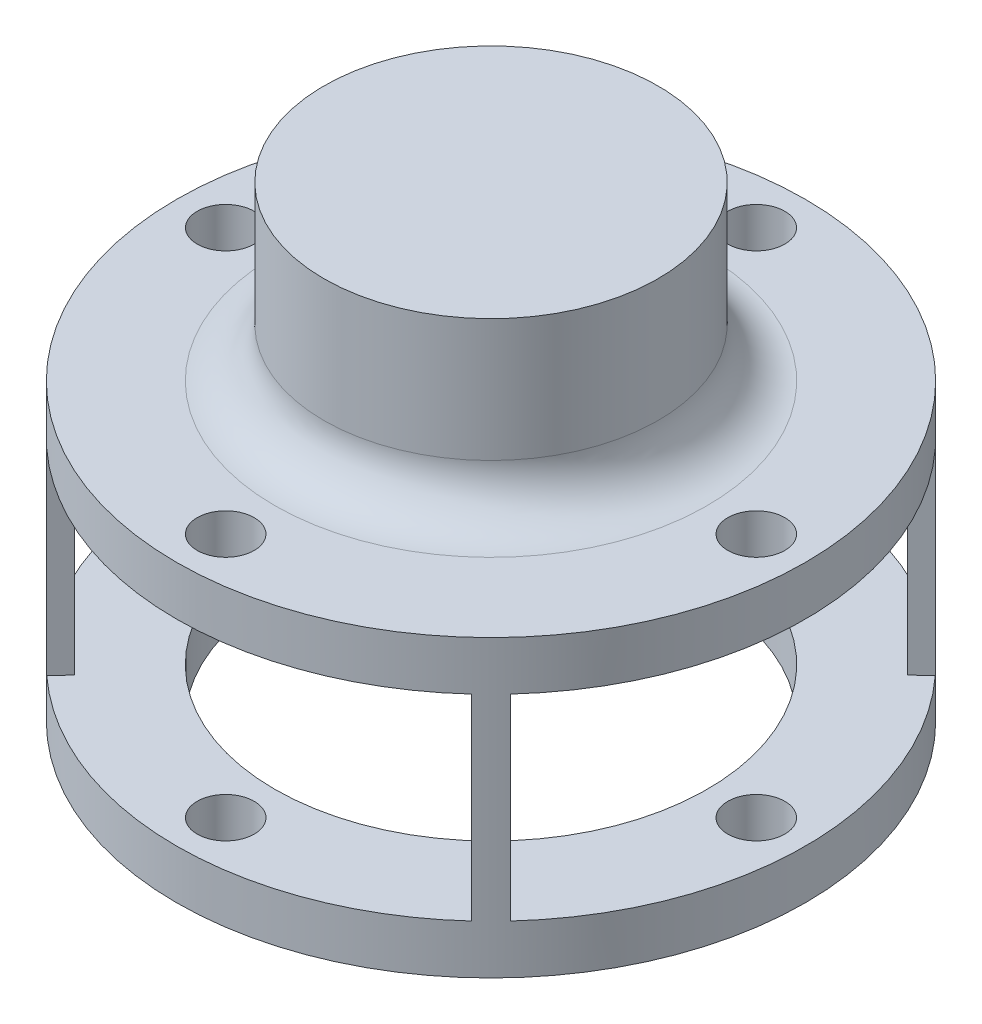
from build123d import *
from build123d.topology import SkipClean

# Parameters (mm, degrees)
SKETCH1_R               = 32
BOSS_EXTRUDE1_DEPTH     = 5
BOSS_EXTRUDE4_DEPTH     = 20
SKETCH5_R               = 32
BOSS_EXTRUDE5_DEPTH     = 5
CUT_EXTRUDE1_DEPTH      = 52.701063819
CUT_EXTRUDE1_DEPTH_BACK = 5
SKETCH2_7_R             = 2.9
SKETCH1_3_R             = 22
CUT_EXTRUDE2_DEPTH      = 10
SKETCH6_R               = 17
BOSS_EXTRUDE7_DEPTH     = 17.5
FILLET1_R               = 5


with BuildPart() as part:
    # Sketch1 → Boss-Extrude1 (new body)
    with BuildSketch(Plane(origin=(0, 0, 0), x_dir=(1, 0, 0), z_dir=(0, 1, 0))):
        Circle(SKETCH1_R)
    extrude(amount=BOSS_EXTRUDE1_DEPTH)

    # Sketch2 → Boss-Extrude4 (add)
    with SkipClean():  # the faces are left unmerged after this step: merging them gives an invalid solid
        with BuildSketch(Plane(origin=(0, 5, 0), x_dir=(1, 0, 0), z_dir=(0, 1, 0))):
            with BuildLine():
                Line((-23.592874778, 21.618886644), (-22.118320104, 20.267706228))
                ThreePointArc((-22.118320104, 20.267706228), (-21.213203436, 21.213203436), (-20.267706228, 22.118320104))
                Line((-20.267706228, 22.118320104), (-21.618886644, 23.592874778))
                ThreePointArc((-21.618886644, 23.592874778), (-22.627416998, 22.627416998), (-23.592874778, 21.618886644))
            make_face()
            with BuildLine():
                Line((23.592874778, 21.618886644), (22.118320104, 20.267706228))
                ThreePointArc((22.118320104, 20.267706228), (21.213203436, 21.213203436), (20.267706228, 22.118320104))
                Line((20.267706228, 22.118320104), (21.618886644, 23.592874778))
                ThreePointArc((21.618886644, 23.592874778), (22.627416998, 22.627416998), (23.592874778, 21.618886644))
            make_face()
            with BuildLine():
                Line((21.618886644, -23.592874778), (20.267706228, -22.118320104))
                ThreePointArc((20.267706228, -22.118320104), (21.213203436, -21.213203436), (22.118320104, -20.267706228))
                Line((22.118320104, -20.267706228), (23.592874778, -21.618886644))
                ThreePointArc((23.592874778, -21.618886644), (22.627416998, -22.627416998), (21.618886644, -23.592874778))
            make_face()
            with BuildLine():
                Line((-23.592874778, -21.618886644), (-22.118320104, -20.267706228))
                ThreePointArc((-22.118320104, -20.267706228), (-21.213203436, -21.213203436), (-20.267706228, -22.118320104))
                Line((-20.267706228, -22.118320104), (-21.618886644, -23.592874778))
                ThreePointArc((-21.618886644, -23.592874778), (-22.627416998, -22.627416998), (-23.592874778, -21.618886644))
            make_face()
        extrude(amount=BOSS_EXTRUDE4_DEPTH)

    # Sketch5 → Boss-Extrude5 (add)
    with SkipClean():  # the faces are left unmerged after this step: merging them gives an invalid solid
        with BuildSketch(Plane(origin=(0, 25, 0), x_dir=(1, 0, 0), z_dir=(0, 1, 0))):
            Circle(SKETCH5_R)
        extrude(amount=BOSS_EXTRUDE5_DEPTH)

    # Sketch2<7> → Cut-Extrude1 (cut, two sides: drawn at the far end of the back side and taken through both)
    with SkipClean():  # the faces are left unmerged after this step: merging them gives an invalid solid
        with BuildSketch(Plane(origin=(0, 5, 0), x_dir=(1, 0, 0), z_dir=(0, 1, 0)).offset(-CUT_EXTRUDE1_DEPTH_BACK)):
            with Locations((0, 27)):
                Circle(SKETCH2_7_R)
            with Locations((27, 0)):
                Circle(SKETCH2_7_R)
            with Locations((0, -27)):
                Circle(SKETCH2_7_R)
            with Locations((-27, 0)):
                Circle(SKETCH2_7_R)
        extrude(amount=CUT_EXTRUDE1_DEPTH + CUT_EXTRUDE1_DEPTH_BACK, mode=Mode.SUBTRACT)

    # Sketch1<3> → Cut-Extrude2 (cut)
    with SkipClean():  # the faces are left unmerged after this step: merging them gives an invalid solid
        with BuildSketch(Plane(origin=(0, 0, 0), x_dir=(1, 0, 0), z_dir=(0, 1, 0))):
            Circle(SKETCH1_3_R)
        extrude(amount=CUT_EXTRUDE2_DEPTH, mode=Mode.SUBTRACT)

    # Sketch6 → Boss-Extrude7 (add)
    with SkipClean():  # the faces are left unmerged after this step: merging them gives an invalid solid
        with BuildSketch(Plane(origin=(0, 30, 0), x_dir=(1, 0, 0), z_dir=(0, 1, 0))):
            Circle(SKETCH6_R)
        extrude(amount=BOSS_EXTRUDE7_DEPTH)

    # Fillet1
    fillet1_edges = [part.edges().sort_by_distance(p)[0] for p in [
        (-17, 30, 0),
    ]]
    fillet(fillet1_edges, radius=FILLET1_R)


solid = part.part
